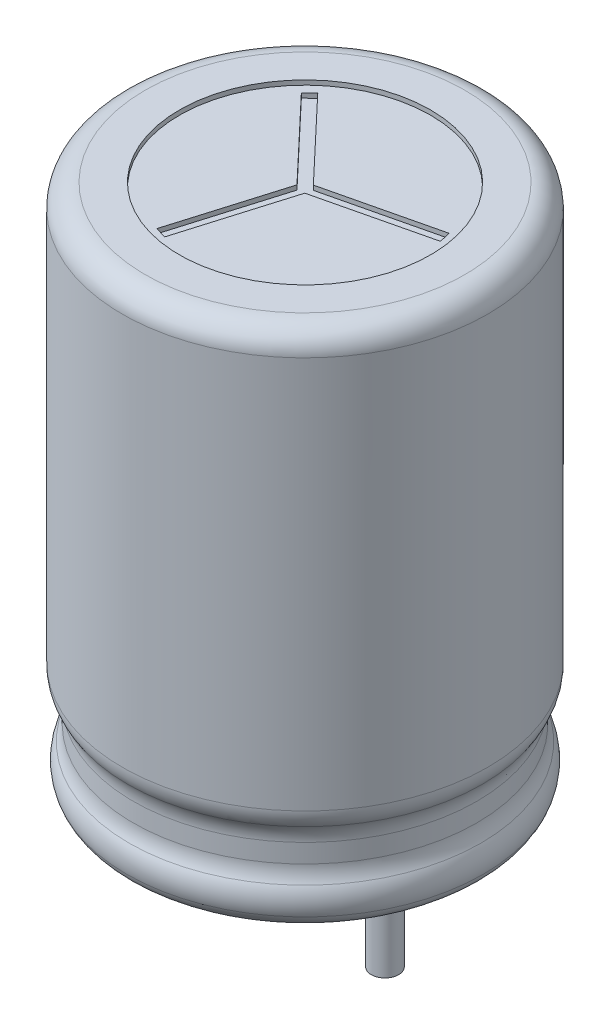
from build123d import *

# Parameters (mm, degrees)
SKETCH2_R          = 2.75
CUT_EXTRUDE1_DEPTH = 0.1
CUT_EXTRUDE2_DEPTH = 0.1
SKETCH4_W          = 0.3
SKETCH4_H          = 2.5
SKETCH5_W          = 0.3
SKETCH5_H          = 2.5
FILLET1_R          = 0.5


with BuildPart() as part:
    # Sketch1 → Revolve1 (revolve)
    with BuildSketch(Plane.XY):
        with BuildLine():
            Line((4, 11.5), (0, 11.5))
            Line((0, 11.5), (0, 0))
            Line((0, 0), (3.643923536, 0))
            ThreePointArc((3.643923536, 0), (3.925044146, 0.40653797), (3.851388969, 0.895288247))
            ThreePointArc((3.851388969, 0.895288247), (3.78355892, 1.057917503), (3.760416667, 1.232599004))
            Line((3.760416667, 1.232599004), (3.760416667, 1.642400996))
            ThreePointArc((3.760416667, 1.642400996), (3.791064683, 1.842850794), (3.880208333, 2.024984899))
            ThreePointArc((3.880208333, 2.024984899), (3.969351983, 2.207119004), (4, 2.407568802))
            Line((4, 2.407568802), (4, 11.5))
        make_face()
    revolve(axis=Axis((0, 11.5, 0), (0, -1, 0)))

    # Sketch2 → Cut-Extrude1 (cut)
    with BuildSketch(Plane(origin=(0, 11.5, 0), x_dir=(-1, 0, 0), z_dir=(0, 1, 0))):
        with Locations(Location((0, 0, 0), (0, 0, 270))):
            Circle(SKETCH2_R)
    extrude(amount=-CUT_EXTRUDE1_DEPTH, mode=Mode.SUBTRACT)

    # Sketch3 → Cut-Extrude2 (cut)
    with BuildSketch(Plane(origin=(0, 11.4, 0), x_dir=(-1, 0, 0), z_dir=(0, 1, 0))):
        Polygon((1.653472744, -1.932293167), (1.837973446, -1.757720858), (0.142645036, 0.03402539), (0.846678598, 2.398095985), (0.603244193, 2.470592124), (-0.10078937, 0.10652153), (-2.500151342, -0.465802817), (-2.441217638, -0.712871266), (-0.041855666, -0.14054692), align=None)
    extrude(amount=-CUT_EXTRUDE2_DEPTH, mode=Mode.SUBTRACT)

    # Sketch4 → Revolve2 (revolve)
    with BuildSketch(Plane(origin=(0, 0, 0), x_dir=(-1, 0, 0), z_dir=(0, 0, -1)), mode=Mode.PRIVATE) as revolve2_sk:
        with Locations((-1.9, -1.25)):
            Rectangle(SKETCH4_W, SKETCH4_H)
    revolve(revolve2_sk.sketch.rotate(Axis((1.75, -2.5, 0), (0, 1, 0)), 270), axis=Axis((1.75, -2.5, 0), (0, 1, 0)))

    # Sketch5 → Revolve3 (revolve)
    with BuildSketch(Plane(origin=(0, 0, 0), x_dir=(-1, 0, 0), z_dir=(0, 0, -1)), mode=Mode.PRIVATE) as revolve3_sk:
        with Locations((1.6, -1.25)):
            Rectangle(SKETCH5_W, SKETCH5_H)
    revolve(revolve3_sk.sketch.rotate(Axis((-1.75, -2.5, 0), (0, 1, 0)), 270), axis=Axis((-1.75, -2.5, 0), (0, 1, 0)))

    # Fillet1
    fillet1_edges = [part.edges().sort_by_distance(p)[0] for p in [
        (-4, 11.5, 0),
        (-3.643923536, 0, 0),
    ]]
    fillet(fillet1_edges, radius=FILLET1_R)


solid = part.part
